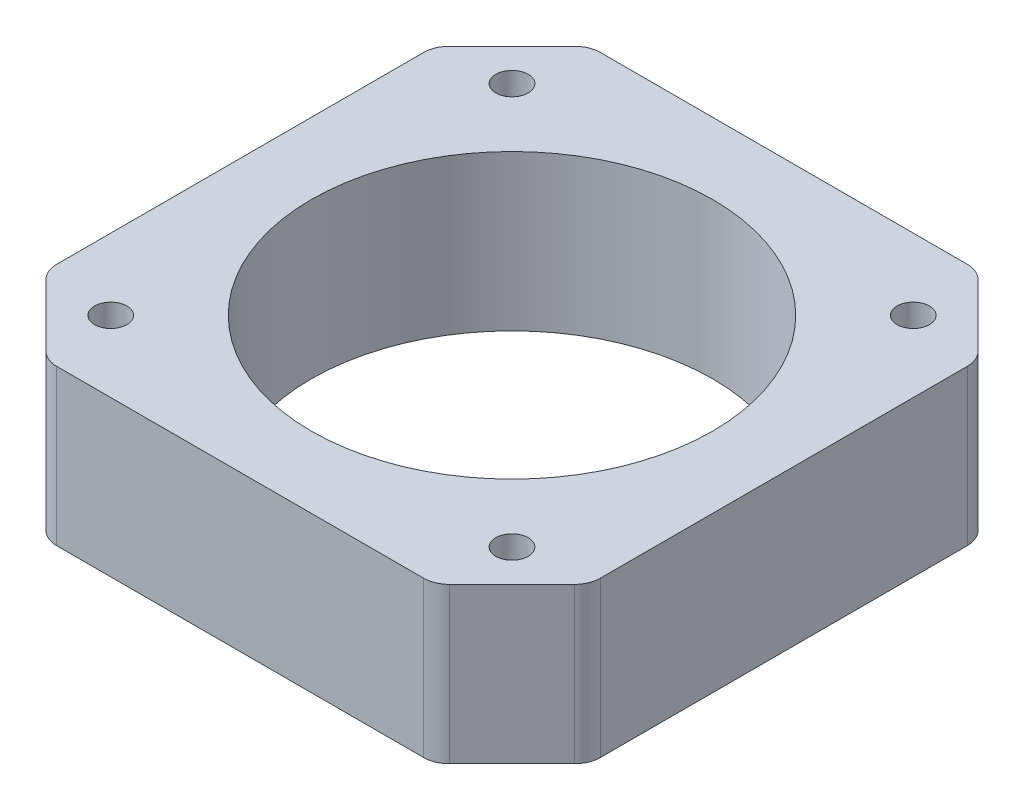
from build123d import *

# Parameters (mm, degrees)
SKETCH1_R           = 15.5
SKETCH1_R_2         = 1.25
BOSS_EXTRUDE2_DEPTH = 12
FILLET1_R           = 2


with BuildPart() as part:
    # Sketch1 → Boss-Extrude2 (new body)
    with BuildSketch(Plane(origin=(0, 0, 0), x_dir=(1, 0, 0), z_dir=(0, 1, 0))):
        Polygon((-15, 21.000989792), (-21, 15.000989792), (-21, -15.000989792), (-15, -21.000989792), (15, -21.000989792), (21, -15.000989792), (21, 15.000989792), (15, 21.000989792), align=None)
        with Locations(Location((0, 0, 0), (0, 0, 270))):
            Circle(SKETCH1_R, mode=Mode.SUBTRACT)
        with Locations(Location((-15.5, 15.5, 0), (0, 0, 270))):
            Circle(SKETCH1_R_2, mode=Mode.SUBTRACT)
        with Locations(Location((15.5, 15.5, 0), (0, 0, 270))):
            Circle(SKETCH1_R_2, mode=Mode.SUBTRACT)
        with Locations(Location((-15.5, -15.5, 0), (0, 0, 270))):
            Circle(SKETCH1_R_2, mode=Mode.SUBTRACT)
        with Locations(Location((15.5, -15.5, 0), (0, 0, 270))):
            Circle(SKETCH1_R_2, mode=Mode.SUBTRACT)
    extrude(amount=BOSS_EXTRUDE2_DEPTH)

    # Fillet1
    fillet1_edges = [part.edges().sort_by_distance(p)[0] for p in [
        (15, 6, -21.000989792),
        (21, 6, -15.000989792),
        (21, 6, 15.000989792),
        (15, 6, 21.000989792),
        (-15, 6, 21.000989792),
        (-21, 6, 15.000989792),
        (-21, 6, -15.000989792),
        (-15, 6, -21.000989792),
    ]]
    fillet(fillet1_edges, radius=FILLET1_R)


solid = part.part
